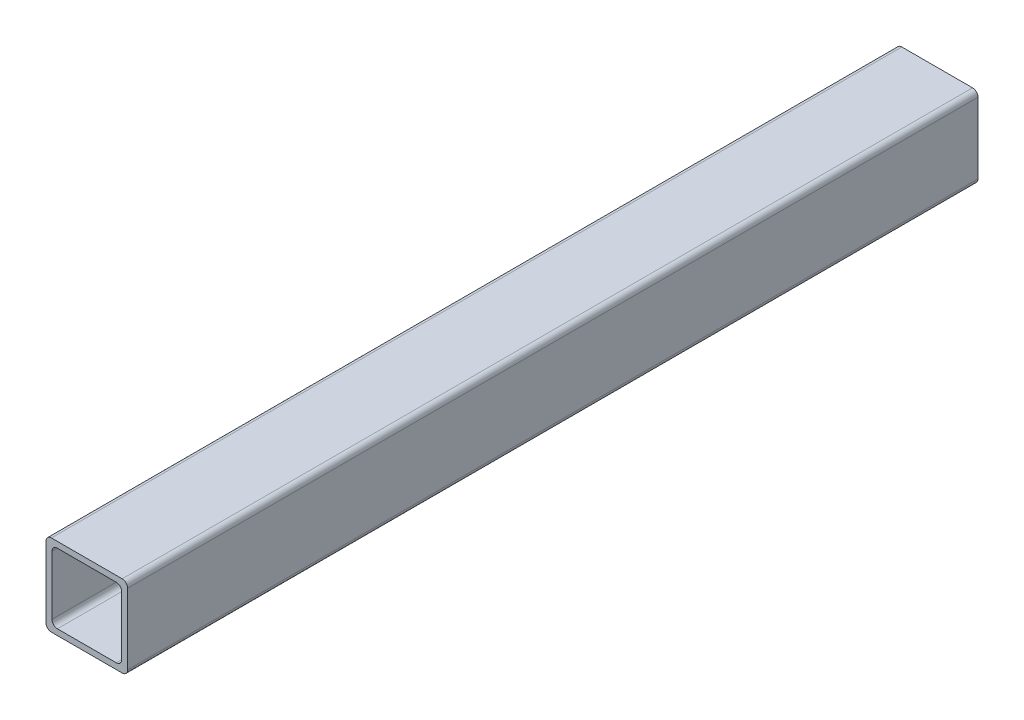
from build123d import *

# Parameters (mm, degrees)
BOSS_EXTRUDE1_DEPTH = 397


with BuildPart() as part:
    # Sketch1 → Boss-Extrude1 (new body)
    with BuildSketch(Plane.XY):
        with BuildLine():
            Line((2.54, 0), (35.56, 0))
            ThreePointArc((35.56, 0), (37.356051224, -0.743948776), (38.1, -2.54))
            Line((38.1, -2.54), (38.1, -35.56))
            ThreePointArc((38.1, -35.56), (37.356051224, -37.356051224), (35.56, -38.1))
            Line((35.56, -38.1), (2.54, -38.1))
            ThreePointArc((2.54, -38.1), (0.743948776, -37.356051224), (0, -35.56))
            Line((0, -35.56), (0, -2.54))
            ThreePointArc((0, -2.54), (0.743948776, -0.743948776), (2.54, 0))
        make_face()
        with BuildLine():
            Line((5.3086, -2.7686), (32.7914, -2.7686))
            ThreePointArc((32.7914, -2.7686), (34.587451224, -3.512548776), (35.3314, -5.3086))
            Line((35.3314, -5.3086), (35.3314, -32.7914))
            ThreePointArc((35.3314, -32.7914), (34.587451224, -34.587451224), (32.7914, -35.3314))
            Line((32.7914, -35.3314), (5.3086, -35.3314))
            ThreePointArc((5.3086, -35.3314), (3.512548776, -34.587451224), (2.7686, -32.7914))
            Line((2.7686, -32.7914), (2.7686, -5.3086))
            ThreePointArc((2.7686, -5.3086), (3.512548776, -3.512548776), (5.3086, -2.7686))
        make_face(mode=Mode.SUBTRACT)
    extrude(amount=BOSS_EXTRUDE1_DEPTH)


solid = part.part
